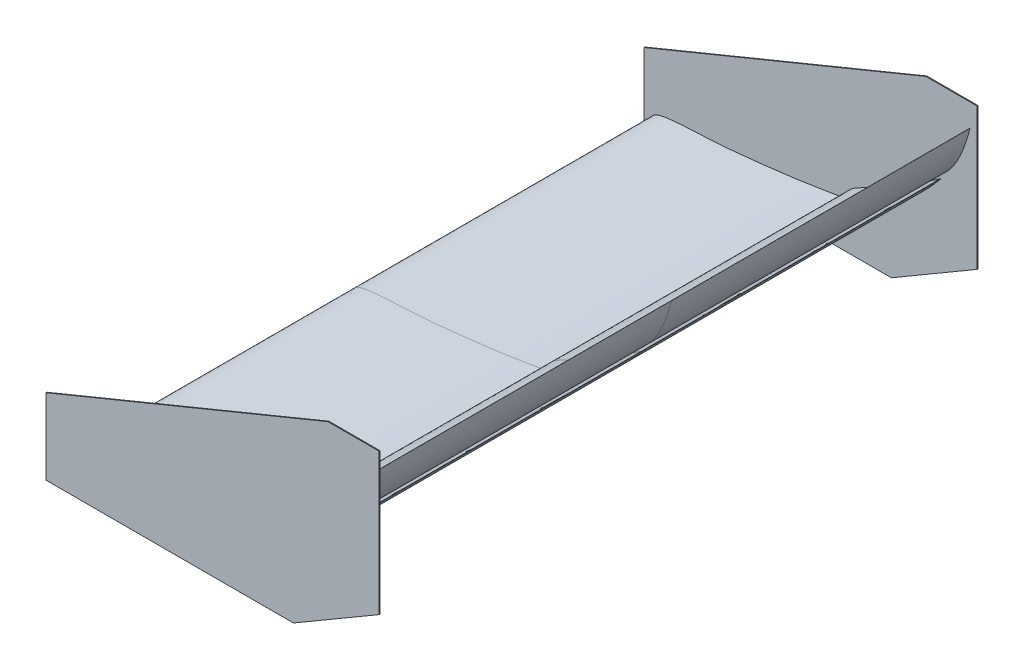
from build123d import *

# Parameters (mm, degrees)
BOSS_EXTRUDE1_DEPTH = 138.1
BOSS_EXTRUDE2_DEPTH = 138.1
BOSS_EXTRUDE3_DEPTH = 138.1
SCALE1_SCALE        = 5
BOSS_EXTRUDE4_DEPTH = 2


with BuildPart() as part:
    # Sketch1 → Boss-Extrude1 (new body)
    with BuildSketch(Plane.XY):
        with BuildLine():
            Line((99.026807, 13.91731), (99.068821, 13.797996))
            add(Edge.make_bspline(
                [(99.068821, 13.797996), (98.984953137, 13.75524506), (98.650798662, 13.584912619), (97.902876236, 13.203166806), (96.660934224, 12.582305), (94.937578485, 11.732475072), (92.744788422, 10.68028636), (90.100814928, 9.451504014), (87.029070729, 8.076284468), (83.556237452, 6.588070244), (79.714534043, 5.021558821), (75.539512528, 3.414202985), (71.073812324, 1.797619193), (66.36106457, 0.209957024), (61.449715706, -1.314750868), (56.391967747, -2.747501031), (51.242573202, -4.057417881), (46.055078044, -5.218371474), (40.854012083, -6.23296413), (35.681348308, -6.993317483), (30.603778052, -7.448968732), (25.729475354, -7.61049197), (21.126224549, -7.499265371), (16.857789129, -7.139410367), (12.982469832, -6.569593605), (9.550654949, -5.832684556), (6.60426204, -4.972122519), (4.176297101, -4.032387515), (2.282994645, -3.056460864), (0.93730666, -2.069524926), (0.102491441, -1.073049296), (-0.113765433, 0.017560463), (0.414099197, 0.989842743), (1.478965299, 1.701876237), (2.998688622, 2.284681182), (4.995504626, 2.758840396), (7.446365595, 3.142029706), (10.325516387, 3.446908616), (13.597317136, 3.693067519), (17.224987935, 3.900612832), (21.168894909, 4.098532451), (25.38974264, 4.311768168), (29.846877027, 4.567553094), (34.498967334, 4.894530126), (39.339425925, 5.328527795), (44.326593181, 5.855468427), (49.419197702, 6.391844384), (54.523354308, 6.965922242), (59.581861206, 7.573105942), (64.540087961, 8.211752924), (69.343210025, 8.876407235), (73.938121529, 9.556571828), (78.274050563, 10.237290575), (82.301171169, 10.909390997), (85.974677553, 11.548069542), (89.252668521, 12.145454046), (92.091977272, 12.674683062), (94.475312549, 13.14775288), (96.329720819, 13.475241853), (97.741523848, 13.843555037), (98.46730989, 13.840136478), (98.98640278, 14.11845435), (99.017244994, 13.96491254), (99.026807, 13.91731)],
                knots=[0, 0, 0, 0, 0.001371578, 0.005464776, 0.012234801, 0.021601971, 0.033461342, 0.047671248, 0.064081317, 0.082496261, 0.102719145, 0.124527078, 0.147675649, 0.171912571, 0.196978377, 0.222596909, 0.248496766, 0.274385101, 0.300041175, 0.325689987, 0.350525088, 0.374279703, 0.396711251, 0.417576733, 0.436654003, 0.453744387, 0.468679992, 0.481329413, 0.491630702, 0.499615786, 0.505546278, 0.510184983, 0.514824194, 0.520701508, 0.52851604, 0.538465751, 0.550542609, 0.564643256, 0.580638141, 0.598344874, 0.61758446, 0.638174399, 0.659922091, 0.682632115, 0.706120665, 0.730727384, 0.755700242, 0.780731769, 0.805564463, 0.829932397, 0.853570292, 0.876213105, 0.897609984, 0.917519394, 0.935698344, 0.951942677, 0.966047155, 0.977839938, 0.987173998, 0.9939315, 0.998018397, 0.999385644, 1, 1, 1, 1], degree=3))
        make_face()
    extrude(amount=BOSS_EXTRUDE1_DEPTH)


with BuildPart() as body_2:
    # Sketch2 → Boss-Extrude2 (new body)
    with BuildSketch(Plane.XY):
        with BuildLine():
            Line((133.402165509, 41.996300514), (133.44586, 41.950008))
            add(Edge.make_bspline(
                [(133.44586, 41.950008), (133.416245709, 41.91342467), (133.298253093, 41.767665217), (133.034258773, 41.441189486), (132.593235648, 40.905026172), (131.978883804, 40.166369926), (131.191257368, 39.239816032), (130.233458551, 38.140840693), (129.110044884, 36.887982918), (127.826405996, 35.501942142), (126.390198957, 34.005122161), (124.810048428, 32.421858935), (123.099000543, 30.775265491), (121.269225359, 29.091641724), (119.335932992, 27.39638325), (117.317067912, 25.713356111), (115.231360743, 24.067797787), (113.097955136, 22.482534109), (110.928585737, 20.961363969), (108.720486467, 19.562098819), (106.493855569, 18.321353745), (104.300256052, 17.256295132), (102.174996371, 16.370945484), (100.15210837, 15.66725214), (98.266085188, 15.139412932), (96.548661992, 14.778088546), (95.027818804, 14.571967824), (93.727678364, 14.507441324), (92.664397117, 14.568182341), (91.849011672, 14.745315113), (91.265039571, 15.030703928), (90.94446376, 15.484884581), (90.987847184, 16.036347399), (91.329442858, 16.578145503), (91.905087857, 17.153417929), (92.720749258, 17.776090783), (93.762307059, 18.449548845), (95.015422783, 19.174335386), (96.459830139, 19.952156851), (98.074643368, 20.784710461), (99.835862499, 21.677179674), (101.720464533, 22.632967821), (103.704343699, 23.65624263), (105.76279476, 24.751684672), (107.885522734, 25.934319283), (110.056362506, 27.189242129), (112.273442358, 28.469920358), (114.488133075, 29.770166079), (116.675239581, 31.076250591), (118.810141438, 32.376314235), (120.868907052, 33.656713226), (122.829414118, 34.901852139), (124.671510989, 36.094577202), (126.374306044, 37.22056285), (127.922376368, 38.259368863), (129.298184236, 39.198877694), (130.487474723, 40.018040421), (131.47990972, 40.718820967), (132.260352572, 41.245536396), (132.830321922, 41.700888362), (133.162537271, 41.846928147), (133.343042629, 42.079622993), (133.388356317, 42.015761952), (133.402165509, 41.996300514)],
                knots=[0, 0, 0, 0, 0.001371573, 0.005464775, 0.0122348, 0.021601968, 0.033461338, 0.047671249, 0.064081314, 0.082496262, 0.102719144, 0.124527075, 0.147675643, 0.171912566, 0.196978378, 0.222596905, 0.24849676, 0.274385102, 0.300041174, 0.325689987, 0.35052508, 0.374279697, 0.396711248, 0.417576729, 0.436654003, 0.453744387, 0.468679993, 0.481329418, 0.491630697, 0.499615789, 0.505546275, 0.510184983, 0.514824188, 0.520701505, 0.528516042, 0.538465748, 0.550542606, 0.564643255, 0.580638134, 0.598344874, 0.617584456, 0.638174396, 0.659922088, 0.682632109, 0.706120659, 0.730727383, 0.755700242, 0.780731763, 0.805564457, 0.8299324, 0.85357029, 0.876213104, 0.897609987, 0.917519388, 0.935698343, 0.951942679, 0.966047158, 0.977839937, 0.987174003, 0.993931505, 0.998018401, 0.999385641, 1, 1, 1, 1], degree=3))
        make_face()
    extrude(amount=BOSS_EXTRUDE2_DEPTH)


with BuildPart() as body_3:
    # Sketch3 → Boss-Extrude3 (new body)
    with BuildSketch(Plane.XY):
        with BuildLine():
            Line((146.897578, 68.941443), (146.9331, 68.92809))
            add(Edge.make_bspline(
                [(146.9331, 68.92809), (146.926751752, 68.900572298), (146.901458326, 68.79093309), (146.8449633, 68.545435733), (146.748154515, 68.140296138), (146.61113036, 67.580368086), (146.430088272, 66.873535545), (146.202624891, 66.028961368), (145.92632414, 65.057841742), (145.598648732, 63.972756213), (145.217832793, 62.7878017), (144.78212951, 61.518369615), (144.292493462, 60.180355896), (143.748569449, 58.791145016), (143.151881516, 57.368432466), (142.505830248, 55.929808106), (141.813876154, 54.493809323), (141.080342262, 53.077779019), (140.310553408, 51.686855064), (139.487815779, 50.351484014), (138.613390965, 49.096724515), (137.710569155, 47.945396872), (136.797333021, 46.908958117), (135.891525464, 45.997406911), (135.013271232, 45.216689068), (134.182142153, 44.570113609), (133.416201141, 44.05894197), (132.732037765, 43.682178781), (132.142659628, 43.43526606), (131.656350955, 43.316326421), (131.266364747, 43.316631122), (130.974026171, 43.477241609), (130.852374793, 43.786042915), (130.894083544, 44.168069351), (131.053206629, 44.629707697), (131.329296147, 45.180038331), (131.713849417, 45.817171687), (132.198988879, 46.537630666), (132.773340373, 47.33700233), (133.425189593, 48.21071201), (134.140233513, 49.155240277), (134.905161238, 50.166367032), (135.705876127, 51.240000073), (136.527824717, 52.372165233), (137.361502125, 53.568257986), (138.202110709, 54.815989204), (139.06088317, 56.089770292), (139.913219378, 57.373476089), (140.749143799, 58.653075426), (141.558499526, 59.91569689), (142.331970557, 61.14768717), (143.061725522, 62.334819437), (143.741410452, 63.462541766), (144.363528827, 64.517632459), (144.925136448, 65.48501414), (145.419965991, 66.353537072), (145.84586356, 67.10810284), (146.196739072, 67.747050288), (146.479075232, 68.236369682), (146.666677601, 68.631845706), (146.807423153, 68.797980599), (146.843560569, 68.970946103), (146.884794301, 68.948425168), (146.897578, 68.941443)],
                knots=[0, 0, 0, 0, 0.001371572, 0.005464776, 0.012234805, 0.021601963, 0.033461347, 0.047671246, 0.064081308, 0.08249626, 0.102719144, 0.12452707, 0.147675637, 0.171912573, 0.196978379, 0.2225969, 0.248496758, 0.274385099, 0.300041181, 0.325689988, 0.350525089, 0.374279705, 0.396711251, 0.417576727, 0.436653997, 0.453744382, 0.468679995, 0.481329411, 0.491630688, 0.499615789, 0.505546281, 0.510184977, 0.514824183, 0.520701492, 0.528516036, 0.538465747, 0.550542605, 0.564643257, 0.580638138, 0.59834487, 0.617584454, 0.638174391, 0.659922077, 0.682632103, 0.70612066, 0.730727377, 0.75570024, 0.780731757, 0.805564447, 0.829932384, 0.853570283, 0.876213093, 0.897609973, 0.917519385, 0.93569833, 0.951942667, 0.966047146, 0.977839925, 0.98717399, 0.993931496, 0.998018382, 0.999385639, 1, 1, 1, 1], degree=3))
        make_face()
    extrude(amount=BOSS_EXTRUDE3_DEPTH)


with BuildPart() as part_1:
    # Scale1: scaled about (0, 0, 0)
    add(part.part.scale(SCALE1_SCALE))


with BuildPart() as body_2_1:
    # Scale1: scaled about (0, 0, 0)
    add(body_2.part.scale(SCALE1_SCALE))


with BuildPart() as body_3_1:
    # Scale1: scaled about (0, 0, 0)
    add(body_3.part.scale(SCALE1_SCALE))


with BuildPart() as body_4:
    # Sketch5 → Boss-Extrude4 (new body)
    with BuildSketch(Plane.XY.offset(690.5)):
        Polygon((-19.283900235, 129.820479426), (632.994201987, 397.927670909), (751.379195629, 397.927670909), (751.379195629, 70.627982605), (552.9102357, -45.435736651), (-19.283900235, -45.435736651), align=None)
    extrude(amount=BOSS_EXTRUDE4_DEPTH)


with BuildPart() as body_5:
    # Mirror1: mirrored copy
    add(part_1.part.mirror(Plane.XY))


with BuildPart() as body_6:
    # Mirror1 2: mirrored copy
    add(body_2_1.part.mirror(Plane.XY))


with BuildPart() as body_7:
    # Mirror1 3: mirrored copy
    add(body_3_1.part.mirror(Plane.XY))


with BuildPart() as body_8:
    # Mirror1 4: mirrored copy
    add(body_4.part.mirror(Plane.XY))


solid = Compound([part_1.part, body_2_1.part, body_3_1.part, body_4.part, body_5.part, body_6.part, body_7.part, body_8.part])
